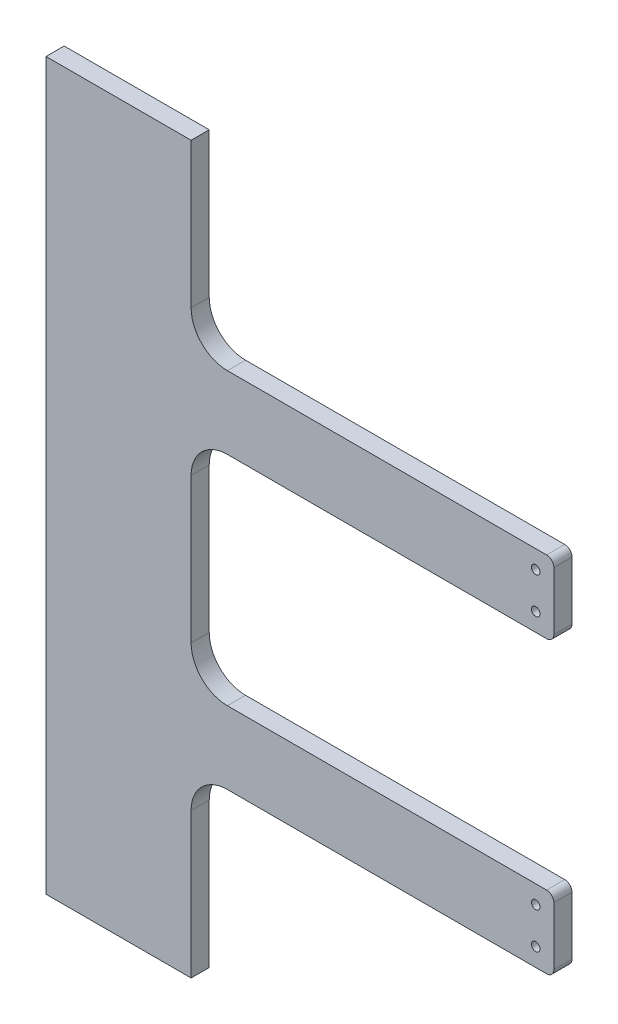
from build123d import *

# Parameters (mm, degrees)
ESQUISSE1_W             = 50.8
ESQUISSE1_H             = 254
BOSS_EXTRU_1_DEPTH      = 6.35
ESQUISSE2_W             = 127
ESQUISSE2_H             = 25.4
BOSS_EXTRU_2_DEPTH      = 6.35
CONG_1_R                = 12.7
CONG_2_R                = 2.54
ESQUISSE3_R             = 1.5
ENL_V_MAT_EXTRU_1_DEPTH = 199.481945023


with BuildPart() as part:
    # Esquisse1 → Boss.-Extru.1 (new body)
    with BuildSketch(Plane.XY):
        Rectangle(ESQUISSE1_W, ESQUISSE1_H)
    extrude(amount=BOSS_EXTRU_1_DEPTH)

    # Esquisse2 → Boss.-Extru.2 (add)
    with BuildSketch(Plane.XY.offset(6.35)):
        with Locations((88.9, -50.8)):
            Rectangle(ESQUISSE2_W, ESQUISSE2_H)
        with Locations((88.9, 50.8)):
            Rectangle(ESQUISSE2_W, ESQUISSE2_H)
    extrude(amount=-BOSS_EXTRU_2_DEPTH)

    # Congé1
    cong_1_edges = [part.edges().sort_by_distance(p)[0] for p in [
        (25.4, -63.5, 3.175),
        (25.4, -38.1, 3.175),
        (25.4, 38.1, 3.175),
        (25.4, 63.5, 3.175),
    ]]
    fillet(cong_1_edges, radius=CONG_1_R)

    # Congé2
    cong_2_edges = [part.edges().sort_by_distance(p)[0] for p in [
        (152.4, -38.1, 3.175),
        (152.4, -63.5, 3.175),
        (152.4, 63.5, 3.175),
        (152.4, 38.1, 3.175),
    ]]
    fillet(cong_2_edges, radius=CONG_2_R)

    # Esquisse3 → Enlèv. mat.-Extru.1 (cut, through all)
    with BuildSketch(Plane(origin=(0, 0, 0), x_dir=(-1, 0, 0), z_dir=(0, 0, -1))):
        with Locations((-146.05, 57.15)):
            Circle(ESQUISSE3_R)
        with Locations((-146.05, 44.45)):
            Circle(ESQUISSE3_R)
        with Locations((-146.05, -44.45)):
            Circle(ESQUISSE3_R)
        with Locations((-146.05, -57.15)):
            Circle(ESQUISSE3_R)
    extrude(amount=-ENL_V_MAT_EXTRU_1_DEPTH, mode=Mode.SUBTRACT)


solid = part.part
